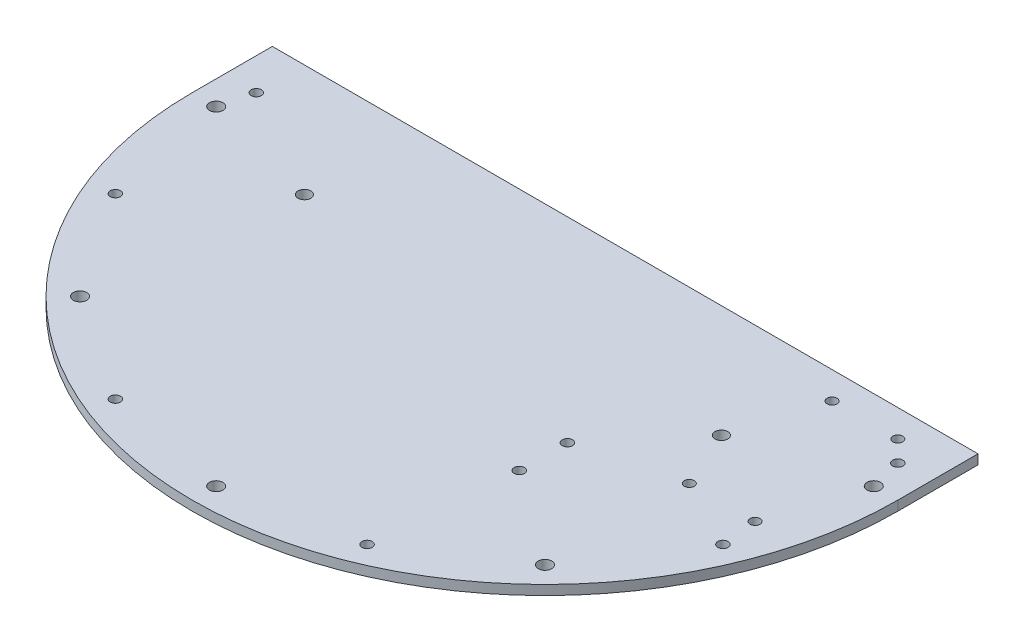
from build123d import *

# Parameters (mm, degrees)
EXTRUDE_1_DEPTH     = 3
SKETCH_2_W          = 220
SKETCH_2_H          = 200
CUT_EXTRUDE_1_DEPTH = 167.535281547
SKETCH_3_R          = 2
SKETCH_3_R_2        = 2.1
SKETCH_3_R_3        = 1.6
CUT_EXTRUDE_2_DEPTH = 10
SKETCH_4_R          = 1.6
CUT_EXTRUDE_3_DEPTH = 156.592416268
SKETCH_4_3_R        = 1.6
SKETCH_4_3_R_2      = 1.55
CUT_EXTRUDE_4_DEPTH = 10


with BuildPart() as part:
    # 草图1 → 凸台-拉伸1 (new body)
    with BuildSketch(Plane(origin=(0, 0, 0), x_dir=(1, 0, 0), z_dir=(0, 1, 0))):
        with BuildLine():
            Line((-110, 0), (-110, 125))
            Line((-110, 125), (110, 125))
            Line((110, 125), (110, 0))
            ThreePointArc((110, 0), (0, -110), (-110, 0))
        make_face()
    extrude(amount=EXTRUDE_1_DEPTH)

    # 草图2 → 切除-拉伸1 (cut, through all)
    with BuildSketch(Plane(origin=(0, 3, 0), x_dir=(1, 0, 0), z_dir=(0, 1, 0))):
        with Locations((0, 125)):
            Rectangle(SKETCH_2_W, SKETCH_2_H)
    extrude(amount=-CUT_EXTRUDE_1_DEPTH, mode=Mode.SUBTRACT)

    # 草图3 → 切除-拉伸2 (cut)
    with BuildSketch(Plane(origin=(0, 3, 0), x_dir=(1, 0, 0), z_dir=(0, 1, 0))):
        with Locations((-65, -10)):
            Circle(SKETCH_3_R)
        with Locations((65, -10)):
            Circle(SKETCH_3_R)
        with Locations((0, -102.5)):
            Circle(SKETCH_3_R_2)
        with Locations((-72.478445072, -72.478445072)):
            Circle(SKETCH_3_R_2)
        with Locations((-102.5, 0)):
            Circle(SKETCH_3_R_2)
        with Locations((102.5, 0)):
            Circle(SKETCH_3_R_2)
        with Locations((72.478445072, -72.478445072)):
            Circle(SKETCH_3_R_2)
        with Locations((-94.697652082, -39.225051817)):
            Circle(SKETCH_3_R_3)
        with Locations((94.697652082, -39.225051817)):
            Circle(SKETCH_3_R_3)
        with Locations((39.225051817, -94.697652082)):
            Circle(SKETCH_3_R_3)
        with Locations((-39.225051817, -94.697652082)):
            Circle(SKETCH_3_R_3)
    extrude(amount=-CUT_EXTRUDE_2_DEPTH, mode=Mode.SUBTRACT)

    # 草图4 → 切除-拉伸3 (cut, through all)
    with BuildSketch(Plane(origin=(0, 3, 0), x_dir=(1, 0, 0), z_dir=(0, 1, 0))):
        with Locations((-100, 10)):
            Circle(SKETCH_4_R)
        with Locations((100, 10)):
            Circle(SKETCH_4_R)
    extrude(amount=-CUT_EXTRUDE_3_DEPTH, mode=Mode.SUBTRACT)

    # 草图4<3> → 切除-拉伸4 (cut)
    with BuildSketch(Plane(origin=(0, 3, 0), x_dir=(1, 0, 0), z_dir=(0, 1, 0))):
        with Locations((-100, 10)):
            Circle(SKETCH_4_3_R)
        with Locations((100, 10)):
            Circle(SKETCH_4_3_R)
        with Locations((43, -36)):
            Circle(SKETCH_4_3_R)
        with Locations((43, -51)):
            Circle(SKETCH_4_3_R)
        with Locations((73, -28)):
            Circle(SKETCH_4_3_R_2)
        with Locations((93.5, -28)):
            Circle(SKETCH_4_3_R_2)
        with Locations((93.5, 16.5)):
            Circle(SKETCH_4_3_R_2)
        with Locations((73, 16.5)):
            Circle(SKETCH_4_3_R_2)
    extrude(amount=-CUT_EXTRUDE_4_DEPTH, mode=Mode.SUBTRACT)


solid = part.part
